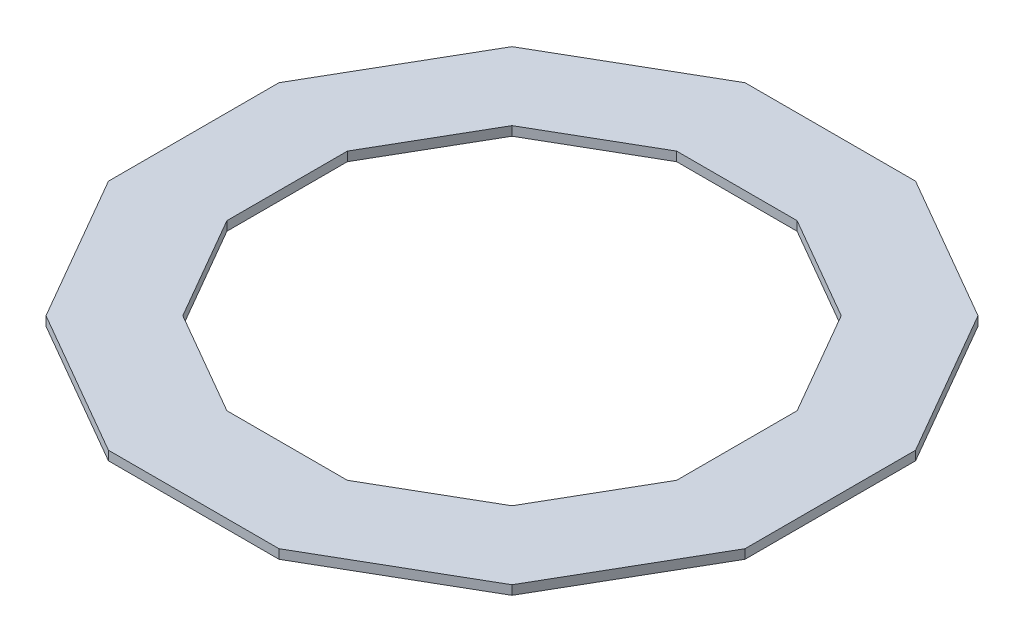
from build123d import *

# Parameters (mm, degrees)
BOSS_EXTRUDE1_DEPTH = 2.921
CUT_EXTRUDE1_DEPTH  = 139.818915977
BOSS_EXTRUDE2_DEPTH = 2.921


with BuildPart() as part:
    # Sketch1 → Boss-Extrude1 (new body)
    with BuildSketch(Plane(origin=(0, 0, 0), x_dir=(1, 0, 0), z_dir=(0, 1, 0))):
        Polygon((98.138063951, 26.296014982), (71.842048969, 71.842048969), (26.296014982, 98.138063951), (-26.296014982, 98.138063951), (-71.842048969, 71.842048969), (-98.138063951, 26.296014982), (-98.138063951, -26.296014982), (-71.842048969, -71.842048969), (-26.296014982, -98.138063951), (26.296014982, -98.138063951), (71.842048969, -71.842048969), (98.138063951, -26.296014982), align=None)
    extrude(amount=-BOSS_EXTRUDE1_DEPTH)

    # Sketch3 → Cut-Extrude1 (cut, through all)
    with BuildSketch(Plane(origin=(0, 0, 0), x_dir=(1, 0, 0), z_dir=(0, 1, 0))):
        Polygon((-71.395441524, 19.1303509), (-52.265090625, 52.265090625), (-19.1303509, 71.395441524), (19.1303509, 71.395441524), (52.265090625, 52.265090625), (71.395441524, 19.1303509), (71.395441524, -19.1303509), (52.265090625, -52.265090625), (19.1303509, -71.395441524), (-19.1303509, -71.395441524), (-52.265090625, -52.265090625), (-71.395441524, -19.1303509), align=None)
    extrude(amount=-CUT_EXTRUDE1_DEPTH, mode=Mode.SUBTRACT)

    # Sketch4 → Boss-Extrude2 (add)
    with BuildSketch(Plane(origin=(0, 0, 0), x_dir=(1, 0, 0), z_dir=(0, 1, 0))):
        Polygon((101.059063951, 27.078694574), (73.980369377, 73.980369377), (27.078694574, 101.059063951), (-27.078694574, 101.059063951), (-73.980369377, 73.980369377), (-101.059063951, 27.078694574), (-101.059063951, -27.078694574), (-73.980369377, -73.980369377), (-27.078694574, -101.059063951), (27.078694574, -101.059063951), (73.980369377, -73.980369377), (101.059063951, -27.078694574), align=None)
        Polygon((98.138063951, 26.296014982), (71.842048969, 71.842048969), (26.296014982, 98.138063951), (-26.296014982, 98.138063951), (-71.842048969, 71.842048969), (-98.138063951, 26.296014982), (-98.138063951, -26.296014982), (-71.842048969, -71.842048969), (-26.296014982, -98.138063951), (26.296014982, -98.138063951), (71.842048969, -71.842048969), (98.138063951, -26.296014982), align=None, mode=Mode.SUBTRACT)
    extrude(amount=-BOSS_EXTRUDE2_DEPTH)


solid = part.part
